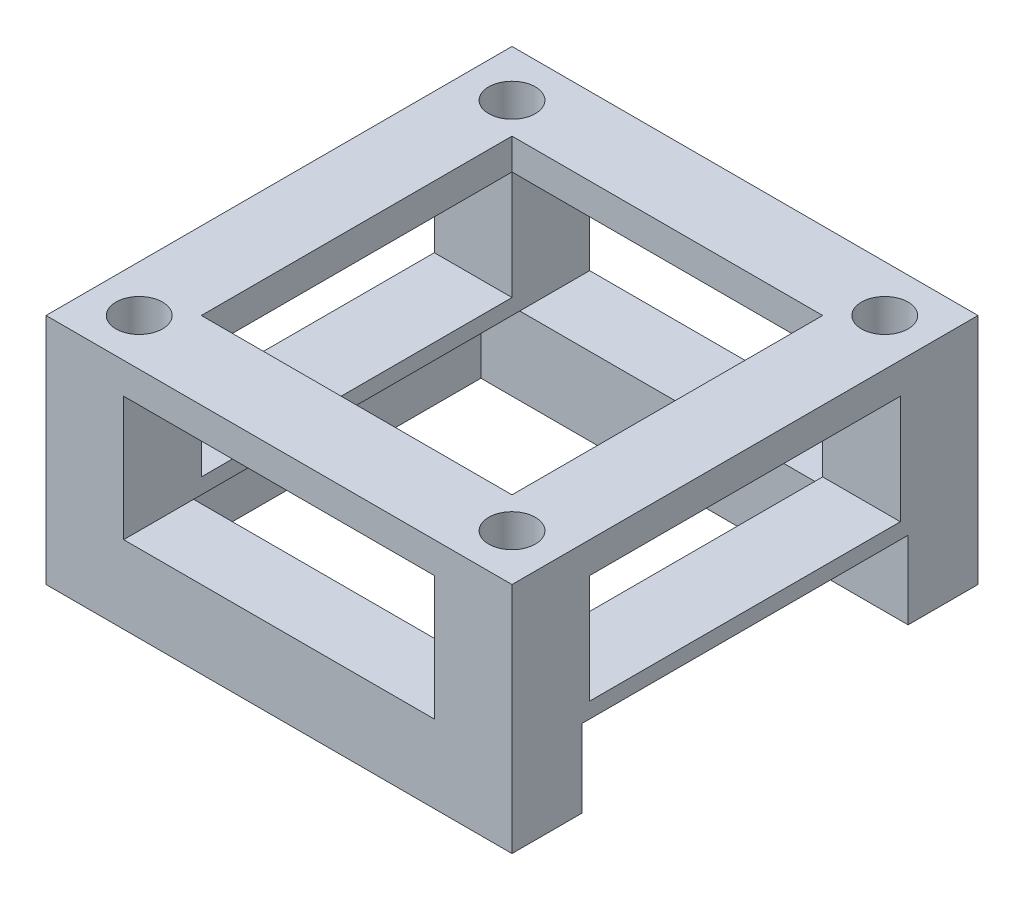
from build123d import *

# Parameters (mm, degrees)
BOSS_EXTRUDE3_DEPTH     = 5
SKETCH2_W               = 30
SKETCH2_H               = 30
SKETCH2_W_2             = 20
SKETCH2_H_2             = 20
BOSS_EXTRUDE4_DEPTH     = 10
SKETCH3_R               = 1.5
CUT_EXTRUDE1_DEPTH      = 5
CUT_EXTRUDE2_DEPTH      = 37.742346142
CUT_EXTRUDE2_DEPTH_BACK = 37.742346142
SKETCH4_W               = 20
SKETCH4_H               = 8
CUT_EXTRUDE3_DEPTH      = 37.742346142
CUT_EXTRUDE3_DEPTH_BACK = 37.742346142
SKETCH5_W               = 20
SKETCH5_H               = 7


with BuildPart() as part:
    # Sketch1 → Boss-Extrude3 (new body)
    with BuildSketch(Plane(origin=(0, 0, 0), x_dir=(1, 0, 0), z_dir=(0, 1, 0))):
        Polygon((-15, 15), (-15, -15), (15, -15), (15, -10.5), (12.5, -10.5), (-12.5, -10.5), (-12.5, 10.5), (12.5, 10.5), (15, 10.5), (15, 15), align=None)
    extrude(amount=BOSS_EXTRUDE3_DEPTH)

    # Sketch2 → Boss-Extrude4 (add)
    with BuildSketch(Plane(origin=(0, 5, 0), x_dir=(1, 0, 0), z_dir=(0, 1, 0))):
        Rectangle(SKETCH2_W, SKETCH2_H)
        Rectangle(SKETCH2_W_2, SKETCH2_H_2, mode=Mode.SUBTRACT)
    extrude(amount=BOSS_EXTRUDE4_DEPTH)

    # Sketch3 → Cut-Extrude1 (cut)
    with BuildSketch(Plane(origin=(0, 15, 0), x_dir=(1, 0, 0), z_dir=(0, 1, 0))):
        with Locations((-12, 12)):
            Circle(SKETCH3_R)
        with Locations((12, 12)):
            Circle(SKETCH3_R)
        with Locations((12, -12)):
            Circle(SKETCH3_R)
        with Locations((-12, -12)):
            Circle(SKETCH3_R)
    extrude(amount=-CUT_EXTRUDE1_DEPTH, mode=Mode.SUBTRACT)

    # Sketch4 → Cut-Extrude2 (cut, two sides: drawn at the far end of the back side and taken through both)
    with BuildSketch(Plane(origin=(0, 0, -15), x_dir=(-1, 0, 0), z_dir=(0, 0, -1)).offset(-CUT_EXTRUDE2_DEPTH_BACK)):
        with Locations((0, 9)):
            Rectangle(SKETCH4_W, SKETCH4_H)
    extrude(amount=CUT_EXTRUDE2_DEPTH + CUT_EXTRUDE2_DEPTH_BACK, mode=Mode.SUBTRACT)

    # Sketch5 → Cut-Extrude3 (cut, two sides: drawn at the far end of the back side and taken through both)
    with BuildSketch(Plane.ZY.offset(15).offset(-CUT_EXTRUDE3_DEPTH_BACK)):
        with Locations((0, 9.5)):
            Rectangle(SKETCH5_W, SKETCH5_H)
    extrude(amount=CUT_EXTRUDE3_DEPTH + CUT_EXTRUDE3_DEPTH_BACK, mode=Mode.SUBTRACT)


solid = part.part
